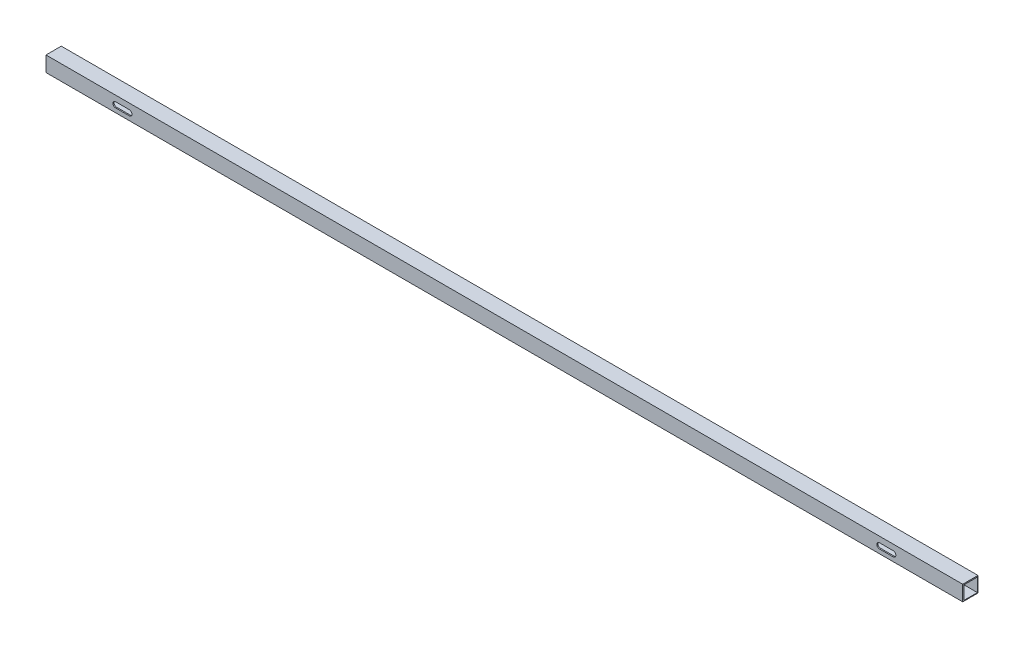
from build123d import *

# Parameters (mm, degrees)
EXTRUDE_1_DEPTH      = 10
EXTRUDE_1_DEPTH_BACK = 10
SKETCH_1_W           = 1200
SKETCH_1_H           = 20
SKETCH_2_W           = 17.726991081
SKETCH_2_H           = 17.586856765
CUT_EXTRUDE_1_DEPTH  = 1201.208315252
CUT_EXTRUDE_2_REACH  = 1202.333
CUT_EXTRUDE_3_REACH  = 1202.333
CUT_EXTRUDE_4_REACH  = 1202.208
SKETCH_5_R           = 6


with BuildPart() as part:
    # ｽｹｯﾁ1 → ﾎﾞｽ - 押し出し1 (new, two sides: drawn at the far end of the back side and taken through both)
    with BuildSketch(Plane.XY.offset(-EXTRUDE_1_DEPTH_BACK)):
        with Locations((600, 10)):
            Rectangle(SKETCH_1_W, SKETCH_1_H)
    extrude(amount=EXTRUDE_1_DEPTH + EXTRUDE_1_DEPTH_BACK)

    # ｽｹｯﾁ2 → ｶｯﾄ - 押し出し1 (cut, through all)
    with BuildSketch(Plane(origin=(1200, 0, 0), x_dir=(0, 0, -1), z_dir=(1, 0, 0))):
        with Locations((0.363495541, 9.706571617)):
            Rectangle(SKETCH_2_W, SKETCH_2_H)
    extrude(amount=-CUT_EXTRUDE_1_DEPTH, mode=Mode.SUBTRACT)

    # ｽｹｯﾁ3 → ｶｯﾄ - 押し出し2 (cut, up to next)
    with BuildSketch(Plane.XY.offset(10), mode=Mode.PRIVATE) as cut_extrude_2_sk1:
        with BuildLine():
            Line((91, 12.5), (109, 12.5))
            ThreePointArc((109, 12.5), (112.5, 9), (109, 5.5))
            Line((109, 5.5), (91, 5.5))
            ThreePointArc((91, 5.5), (87.5, 9), (91, 12.5))
        make_face()
    cut_extrude_2_tool1 = extrude(cut_extrude_2_sk1.sketch, amount=-CUT_EXTRUDE_2_REACH, mode=Mode.PRIVATE) & part.part
    add(cut_extrude_2_tool1.solids().sort_by_distance((100, 9, 10))[0], mode=Mode.SUBTRACT)

    # ｽｹｯﾁ4 → ｶｯﾄ - 押し出し3 (cut, up to next)
    with BuildSketch(Plane.XY.offset(10), mode=Mode.PRIVATE) as cut_extrude_3_sk1:
        with BuildLine():
            Line((1091, 12.5), (1109, 12.5))
            ThreePointArc((1109, 12.5), (1112.5, 9), (1109, 5.5))
            Line((1109, 5.5), (1091, 5.5))
            ThreePointArc((1091, 5.5), (1087.5, 9), (1091, 12.5))
        make_face()
    cut_extrude_3_tool1 = extrude(cut_extrude_3_sk1.sketch, amount=-CUT_EXTRUDE_3_REACH, mode=Mode.PRIVATE) & part.part
    add(cut_extrude_3_tool1.solids().sort_by_distance((1100, 9, 10))[0], mode=Mode.SUBTRACT)

    # ｽｹｯﾁ5 → ｶｯﾄ - 押し出し4 (cut, up to next)
    with BuildSketch(Plane.XZ, mode=Mode.PRIVATE) as cut_extrude_4_sk1:
        with Locations((600, 0)):
            Circle(SKETCH_5_R)
    cut_extrude_4_tool1 = extrude(cut_extrude_4_sk1.sketch, amount=-CUT_EXTRUDE_4_REACH, mode=Mode.PRIVATE) & part.part
    add(cut_extrude_4_tool1.solids().sort_by_distance((600, 0, 0))[0], mode=Mode.SUBTRACT)


solid = part.part
